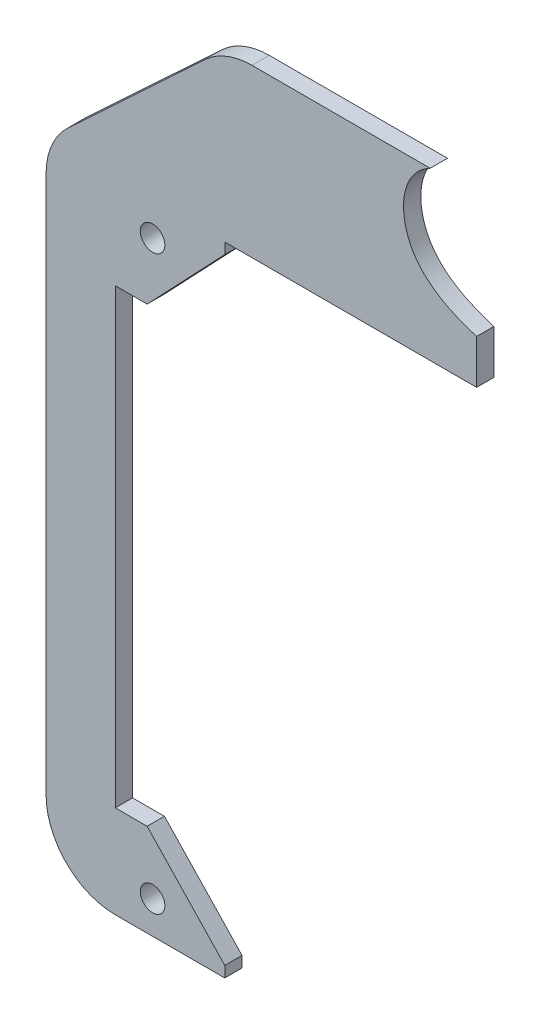
from build123d import *

# Parameters (mm, degrees)
F_3DSKETCH1_R         = 2.25
BOSS_EXTRUDE1_DEPTH   = 3.175
BOSS_EXTRUDE1_2_DEPTH = 3.175
BOSS_EXTRUDE1_3_DEPTH = 3.175
SKETCH2_W             = 3.175
SKETCH2_H             = 22.959761953
BOSS_EXTRUDE2_DEPTH   = 41.91
SKETCH3_W             = 67.66
SKETCH3_H             = 3.175
SKETCH3_W_2           = 7.05
BOSS_EXTRUDE3_DEPTH   = 7.62
SKETCH4_W             = 3.175
SKETCH4_H             = 30.579761953
BOSS_EXTRUDE4_DEPTH   = 4.318
CUT_EXTRUDE1_DEPTH    = 5.08
FILLET1_R             = 12.7


with BuildPart() as part:
    # 3DSketch1 → Boss-Extrude1 (new body)
    with BuildSketch(Plane(origin=(-464.25, 116.5, 0), x_dir=(-0.27427932364426477, -0.9616500676551969, 0), z_dir=(0, 0, -1))):
        Polygon((-1.923300135, 0.548558647), (0, 0), (18.333231377, 9.589323609), (19.93776542, 15.214976505), (99.754721035, -7.550207357), (98.150186992, -13.175860253), (108.666457645, -30.993563572), (110.58975778, -31.542122219), (117.652450364, -6.779632977), (5.139392449, 25.311047889), align=None)
        with Locations(Location((108.454058413, -17.154582881, 0), (0, 0, 254.080928829))):
            Circle(F_3DSKETCH1_R, mode=Mode.SUBTRACT)
        with Locations(Location((7.480801309, 11.644746102, 0), (0, 0, 254.080928829))):
            Circle(F_3DSKETCH1_R, mode=Mode.SUBTRACT)
    extrude(amount=-BOSS_EXTRUDE1_DEPTH)



with BuildPart() as body_2:
    # 3DSketch1 → Boss-Extrude1 2 (new body)
    with BuildSketch(Plane(origin=(-464.25, 116.5, 0), x_dir=(-0.27427932364426477, -0.9616500676551969, 0), z_dir=(0, 0, -1))):
        Polygon((-24.002556771, 6.845946627), (-1.923300135, 0.548558647), (5.139392449, 25.311047889), (-16.939864187, 31.608435869), align=None)
    extrude(amount=-BOSS_EXTRUDE1_2_DEPTH)


with BuildPart() as body_3:
    # 3DSketch1 → Boss-Extrude1 3 (new body)
    with BuildSketch(Plane(origin=(-464.25, 116.5, 0), x_dir=(-0.27427932364426477, -0.9616500676551969, 0), z_dir=(0, 0, -1))):
        Polygon((-16.939864187, 31.608435869), (5.139392449, 25.311047889), (117.652450364, -6.779632977), (119.586119596, 0), (-15.006194955, 38.388068846), align=None)
    extrude(amount=-BOSS_EXTRUDE1_3_DEPTH)


with BuildPart() as part_1:
    add(part.part)

    add(body_2.part)  # Boss-Extrude2 merges body 2
    # Sketch2 → Boss-Extrude2 (add)
    with BuildSketch(Plane(origin=(-464.25, 0, 0), x_dir=(0, 0, -1), z_dir=(1, 0, 0))):
        with Locations((-1.5875, 129.979880976)):
            Rectangle(SKETCH2_W, SKETCH2_H)
    extrude(amount=BOSS_EXTRUDE2_DEPTH)


    add(body_3.part)  # Boss-Extrude3 merges body 3
    # Sketch3 → Boss-Extrude3 (add)
    with BuildSketch(Plane(origin=(0, 141.459761953, 0), x_dir=(1, 0, 0), z_dir=(0, 1, 0))):
        with Locations((-456.17, -1.5875)):
            Rectangle(SKETCH3_W, SKETCH3_H)
        with Locations((-493.525, -1.5875)):
            Rectangle(SKETCH3_W_2, SKETCH3_H)
    extrude(amount=BOSS_EXTRUDE3_DEPTH)

    # Sketch4 → Boss-Extrude4 (add)
    with BuildSketch(Plane(origin=(-422.34, 0, 0), x_dir=(0, 0, -1), z_dir=(1, 0, 0))):
        with Locations((-1.5875, 133.789880977)):
            Rectangle(SKETCH4_W, SKETCH4_H)
    extrude(amount=BOSS_EXTRUDE4_DEPTH)

    # Sketch5 → Cut-Extrude1 (cut)
    with BuildSketch(Plane.XY.offset(3.175)):
        with BuildLine():
            Line((-426.539082165, 149.079761953), (-418.022, 149.079761953))
            Line((-418.022, 149.079761953), (-418.022, 126.606320753))
            add(Edge.make_bspline(
                [(-418.022, 126.606320753), (-422.206786757, 127.841281747), (-432.70768746, 132.592685738), (-432.363764658, 146.022941569), (-426.539082165, 149.079761953)],
                knots=[0, 0, 0, 0, 0.445070819, 1, 1, 1, 1], degree=3))
        make_face()
        Polygon((-497.05, 118.5), (-464.25, 149.079761953), (-497.05, 149.079761953), align=None)
    extrude(amount=-CUT_EXTRUDE1_DEPTH, mode=Mode.SUBTRACT)

    # Fillet1
    fillet1_edges = [part_1.edges().sort_by_distance(p)[0] for p in [
        (-497.05, 1.5, 1.5875),
        (-464.25, 149.079761953, 1.5875),
        (-497.05, 118.5, 1.5875),
    ]]
    fillet(fillet1_edges, radius=FILLET1_R)


solid = part_1.part
